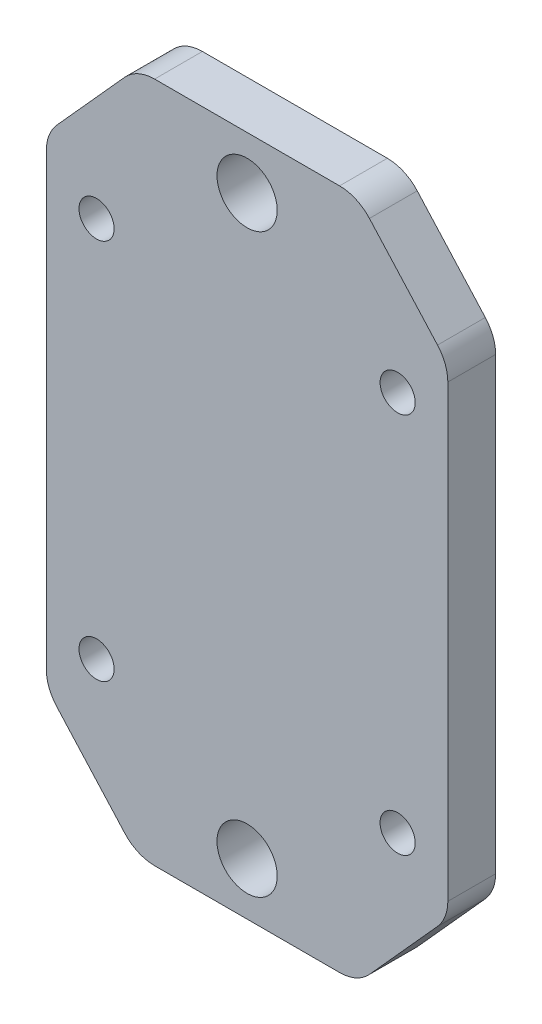
from build123d import *
from OCP.BRepFilletAPI import BRepFilletAPI_MakeChamfer

# Parameters (mm, degrees)
SKETCH1_W           = 40
SKETCH1_H           = 67.88
SKETCH1_R           = 3
SKETCH1_R_2         = 1.75
BOSS_EXTRUDE1_DEPTH = 4.7625
CHAMFER1_SIZE       = 10
CHAMFER1_SIZE2      = 9.004040443
FILLET1_R           = 4


with BuildPart() as part:
    # Sketch1 → Boss-Extrude1 (new body)
    with BuildSketch(Plane.XY):
        Rectangle(SKETCH1_W, SKETCH1_H)
        with Locations(Location((4.07e-07, 28.72, 0), (0, 0, 180))):
            Circle(SKETCH1_R, mode=Mode.SUBTRACT)
        with Locations(Location((-4.07e-07, -28.72, 0), (0, 0, 180))):
            Circle(SKETCH1_R, mode=Mode.SUBTRACT)
        with Locations(Location((-14.999999995, 19, 0), (0, 0, 180))):
            Circle(SKETCH1_R_2, mode=Mode.SUBTRACT)
        with Locations(Location((-14.999999995, -19, 0), (0, 0, 180))):
            Circle(SKETCH1_R_2, mode=Mode.SUBTRACT)
        with Locations(Location((15.000000005, 19, 0), (0, 0, 180))):
            Circle(SKETCH1_R_2, mode=Mode.SUBTRACT)
        with Locations(Location((15.000000005, -19, 0), (0, 0, 180))):
            Circle(SKETCH1_R_2, mode=Mode.SUBTRACT)
    extrude(amount=BOSS_EXTRUDE1_DEPTH)

    # Chamfer1: one chamfer whose edges measure the first distance from different faces: ONE call of the kernel's chamfer builder (chamfer() names one face for all edges)
    chamfer1_edges_1 = [part.edges().sort_by_distance(p)[0] for p in [
        (20, -33.94, 2.38125),
        (20, 33.94, 2.38125),
    ]]
    chamfer1_side_1 = [part.faces().sort_by_distance(p)[0] for p in [
        (20, 0, 2.38125),
    ]]
    chamfer1_edges_2 = [part.edges().sort_by_distance(p)[0] for p in [
        (-20, -33.94, 2.38125),
        (-20, 33.94, 2.38125),
    ]]
    chamfer1_side_2 = [part.faces().sort_by_distance(p)[0] for p in [
        (-20, 0, 2.38125),
    ]]
    chamfer1 = BRepFilletAPI_MakeChamfer(part.part.solid().wrapped)
    for e in chamfer1_edges_1:
        chamfer1.Add(CHAMFER1_SIZE, CHAMFER1_SIZE2, e.wrapped, chamfer1_side_1[0].wrapped)  # the first distance lies on this face
    for e in chamfer1_edges_2:
        chamfer1.Add(CHAMFER1_SIZE, CHAMFER1_SIZE2, e.wrapped, chamfer1_side_2[0].wrapped)  # the first distance lies on this face
    add(Compound.cast(chamfer1.Shape()), mode=Mode.REPLACE)

    # Fillet1
    fillet1_edges = [part.edges().sort_by_distance(p)[0] for p in [
        (-20, -23.94, 2.38125),
        (-20, 23.94, 2.38125),
        (10.995959557, 33.94, 2.38125),
        (-10.995959557, 33.94, 2.38125),
        (10.995959557, -33.94, 2.38125),
        (-10.995959557, -33.94, 2.38125),
        (20, -23.94, 2.38125),
        (20, 23.94, 2.38125),
    ]]
    fillet(fillet1_edges, radius=FILLET1_R)


solid = part.part
